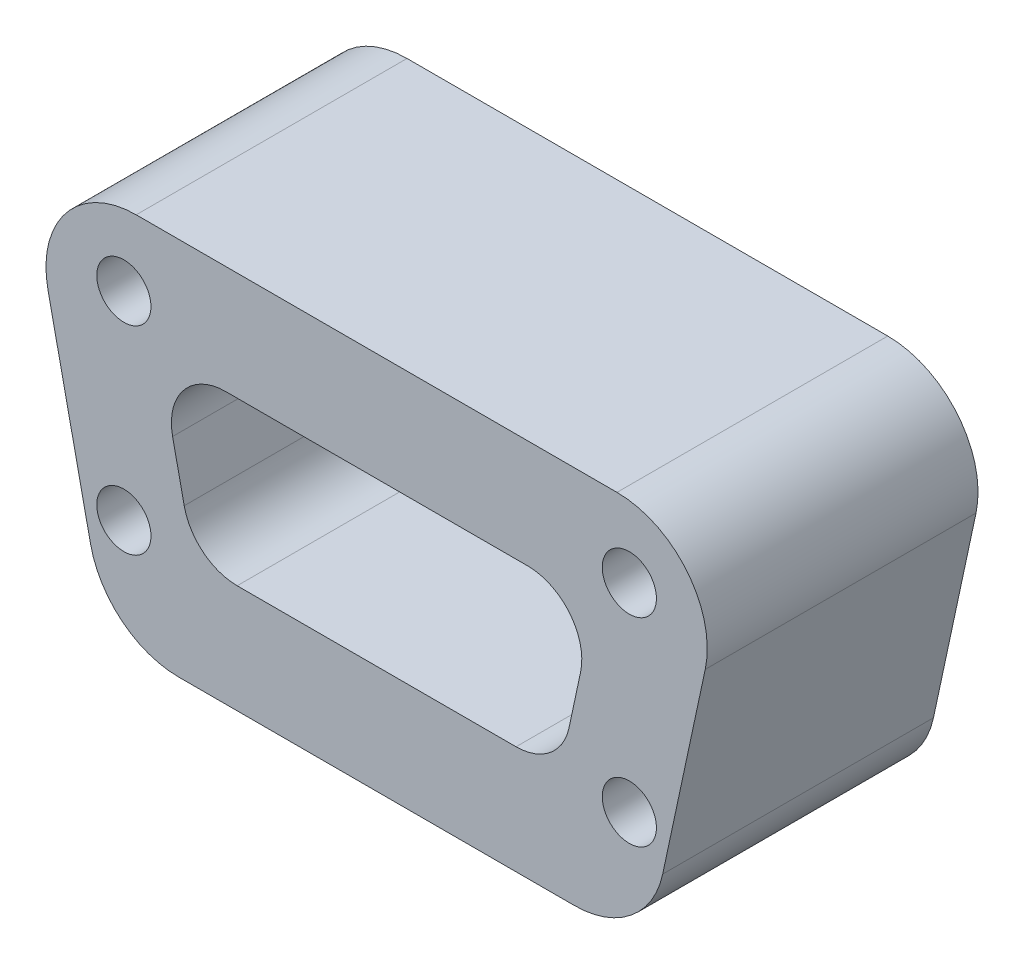
from build123d import *

# Parameters (mm, degrees)
SKETCH_1_R      = 1.5
EXTRUDE_1_DEPTH = 15
FILLET_1_R      = 5
FILLET_2_R      = 3


with BuildPart() as part:
    # 草图1 → 凸台-拉伸1 (new body)
    with BuildSketch(Plane.XY):
        Polygon((19.5, 9.5), (-19.5, 9.5), (-15, -11.5), (15, -11.5), align=None)
        with Locations((14, -5.5)):
            Circle(SKETCH_1_R, mode=Mode.SUBTRACT)
        with Locations((-14, -5.5)):
            Circle(SKETCH_1_R, mode=Mode.SUBTRACT)
        with Locations((-14, 5.5)):
            Circle(SKETCH_1_R, mode=Mode.SUBTRACT)
        with Locations((14, 5.5)):
            Circle(SKETCH_1_R, mode=Mode.SUBTRACT)
        Polygon((-12.078076687, 3.5), (-10.149505259, -5.5), (10.149505259, -5.5), (12.078076687, 3.5), align=None, mode=Mode.SUBTRACT)
    extrude(amount=EXTRUDE_1_DEPTH)

    # 圆角1
    fillet_1_edges = [part.edges().sort_by_distance(p)[0] for p in [
        (15, -11.5, 7.5),
        (-15, -11.5, 7.5),
        (-19.5, 9.5, 7.5),
        (19.5, 9.5, 7.5),
    ]]
    fillet(fillet_1_edges, radius=FILLET_1_R)

    # 圆角2
    fillet_2_edges = [part.edges().sort_by_distance(p)[0] for p in [
        (12.078076687, 3.5, 7.5),
        (-12.078076687, 3.5, 7.5),
        (-10.149505259, -5.5, 7.5),
        (10.149505259, -5.5, 7.5),
    ]]
    fillet(fillet_2_edges, radius=FILLET_2_R)


solid = part.part
